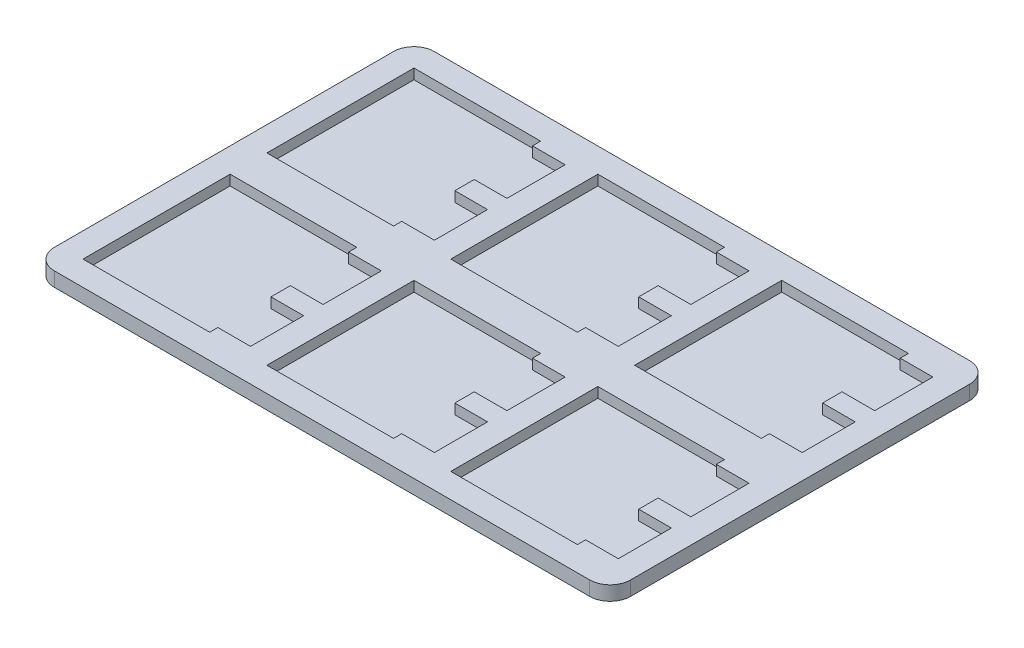
from build123d import *

# Parameters (mm, degrees)
BOSS_EXTRUDE1_DEPTH = 7
CUT_EXTRUDE1_DEPTH  = 5


with BuildPart() as part:
    # Sketch2 → Boss-Extrude1 (new body)
    with BuildSketch(Plane(origin=(0, 0, 0), x_dir=(1, 0, 0), z_dir=(0, 1, 0))):
        with BuildLine():
            Line((10, 0), (272, 0))
            ThreePointArc((272, 0), (279.071067812, 2.928932188), (282, 10))
            Line((282, 10), (282, 175.95))
            ThreePointArc((282, 175.95), (279.071067812, 183.021067812), (272, 185.95))
            Line((272, 185.95), (10, 185.95))
            ThreePointArc((10, 185.95), (2.928932188, 183.021067812), (0, 175.95))
            Line((0, 175.95), (0, 10))
            ThreePointArc((0, 10), (2.928932188, 2.928932188), (10, 0))
        make_face()
    extrude(amount=BOSS_EXTRUDE1_DEPTH)

    # Sketch3 → Cut-Extrude1 (cut)
    with BuildSketch(Plane(origin=(0, 7, 0), x_dir=(1, 0, 0), z_dir=(0, 1, 0))):
        Polygon((74, 16), (90, 16), (90, 42), (74, 42), (74, 51.5), (90, 51.5), (90, 80), (74, 80), (74, 84), (12, 84), (12, 12), (74, 12), align=None)
        Polygon((180, 42), (164, 42), (164, 51.5), (180, 51.5), (180, 80), (164, 80), (164, 84), (102, 84), (102, 12), (164, 12), (164, 16), (180, 16), align=None)
        Polygon((270, 42), (254, 42), (254, 51.5), (270, 51.5), (270, 80), (254, 80), (254, 84), (192, 84), (192, 12), (254, 12), (254, 16), (270, 16), align=None)
        Polygon((180, 132), (164, 132), (164, 141.5), (180, 141.5), (180, 170), (164, 170), (164, 174), (102, 174), (102, 102), (164, 102), (164, 106), (180, 106), align=None)
        Polygon((270, 132), (254, 132), (254, 141.5), (270, 141.5), (270, 170), (254, 170), (254, 174), (192, 174), (192, 102), (254, 102), (254, 106), (270, 106), align=None)
        Polygon((90, 132), (74, 132), (74, 141.5), (90, 141.5), (90, 170), (74, 170), (74, 174), (12, 174), (12, 102), (74, 102), (74, 106), (90, 106), align=None)
    extrude(amount=-CUT_EXTRUDE1_DEPTH, mode=Mode.SUBTRACT)


solid = part.part
